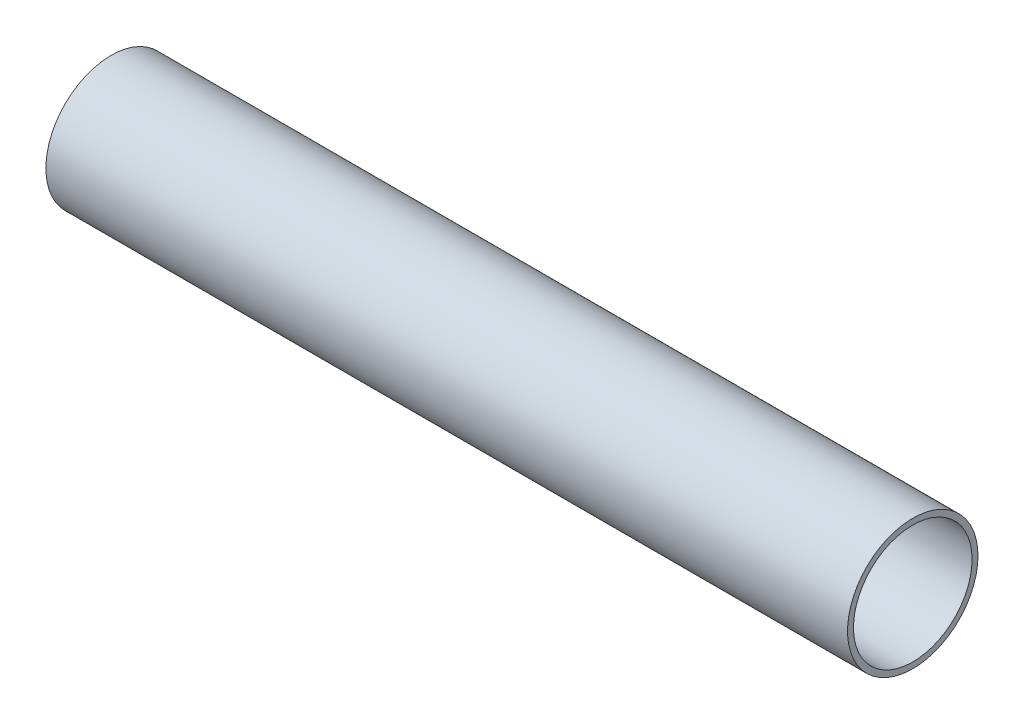
from build123d import *

# Parameters (mm, degrees)
SZKIC1_R                    = 27.5
SZKIC1_R_2                  = 25
DODANIE_WYCI_GNI_CIE1_DEPTH = 338


with BuildPart() as part:
    # Szkic1 → Dodanie-wyciągnięcie1 (new body)
    with BuildSketch(Plane(origin=(0, 0, 0), x_dir=(0, 0, -1), z_dir=(1, 0, 0))):
        Circle(SZKIC1_R)
        Circle(SZKIC1_R_2, mode=Mode.SUBTRACT)
    extrude(amount=-DODANIE_WYCI_GNI_CIE1_DEPTH)


solid = part.part
